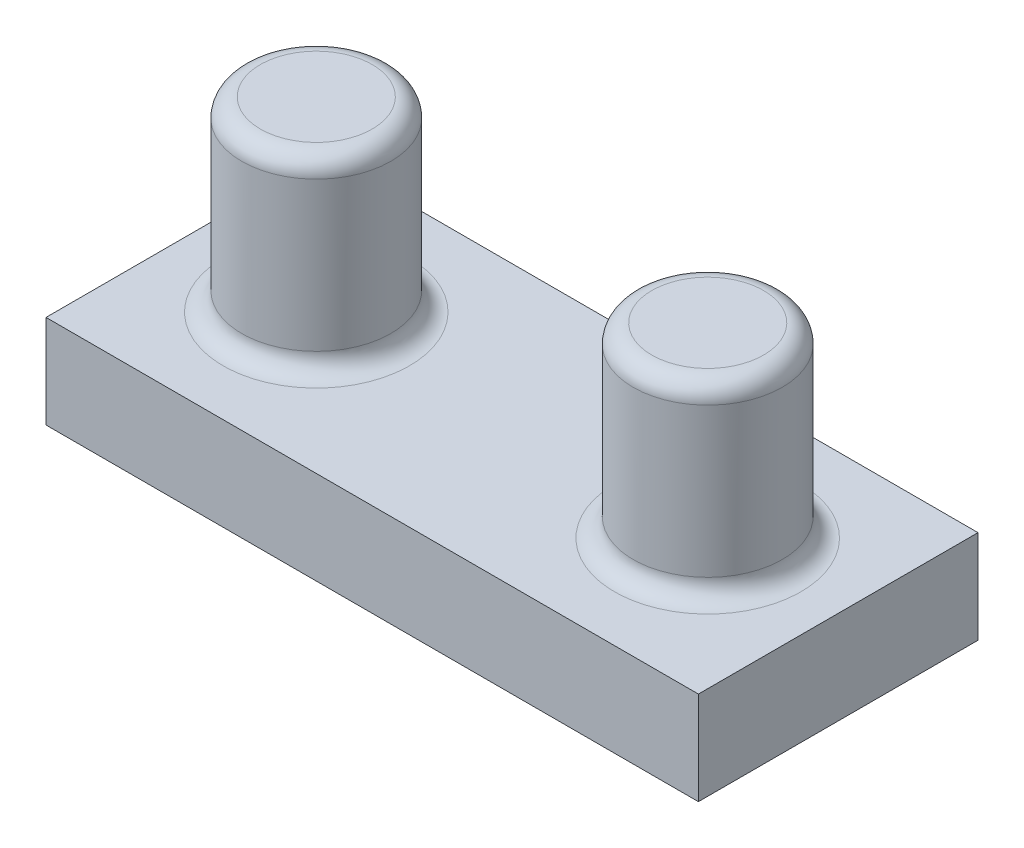
from build123d import *

# Parameters (mm, degrees)
SKETCH1_R             = 4
BOSS_EXTRUDE1_DEPTH   = 10
BOSS_EXTRUDE1_2_DEPTH = 10
SKETCH2_W             = 35
SKETCH2_H             = 15
BOSS_EXTRUDE2_DEPTH   = 5
FILLET1_R             = 1
CUT_EXTRUDE1_DEPTH    = 1


with BuildPart() as part:
    # Sketch1 → Boss-Extrude1 (new body)
    with BuildSketch(Plane(origin=(0, 0, 0), x_dir=(1, 0, 0), z_dir=(0, 1, 0))):
        with Locations(Location((10.086709746, 7.169703638, 0), (0, 0, 270))):
            Circle(SKETCH1_R)
    extrude(amount=BOSS_EXTRUDE1_DEPTH)



with BuildPart() as body_2:
    # Sketch1 → Boss-Extrude1 2 (new body)
    with BuildSketch(Plane(origin=(0, 0, 0), x_dir=(1, 0, 0), z_dir=(0, 1, 0))):
        with Locations(Location((-10.913290254, 7.169703638, 0), (0, 0, 270))):
            Circle(SKETCH1_R)
    extrude(amount=BOSS_EXTRUDE1_2_DEPTH)


with BuildPart() as part_1:
    add(part.part)

    add(body_2.part)  # Boss-Extrude2 merges body 2
    # Sketch2 → Boss-Extrude2 (add)
    with BuildSketch(Plane(origin=(0, 0, 0), x_dir=(-1, 0, 0), z_dir=(0, -1, 0))):
        with Locations((0.413290254, 7.169703638)):
            Rectangle(SKETCH2_W, SKETCH2_H)
    extrude(amount=BOSS_EXTRUDE2_DEPTH)

    # Fillet1
    fillet1_edges = [part_1.edges().sort_by_distance(p)[0] for p in [
        (-10.913290254, 0, -11.169703638),
        (-10.913290254, 10, -11.169703638),
        (10.086709746, 10, -11.169703638),
        (10.086709746, 0, -11.169703638),
    ]]
    fillet(fillet1_edges, radius=FILLET1_R)

    # Sketch3 → Cut-Extrude1 (cut)
    with BuildSketch(Plane(origin=(0, 0, -14.669703638), x_dir=(-1, 0, 0), z_dir=(0, 0, -1))):
        with BuildLine():
            Line((4.304418078, -1.853490886), (4.618520642, -1.853490886))
            Line((4.618520642, -1.853490886), (4.618520642, -2.298002104))
            add(Edge.make_bspline(
                [(4.618520642, -2.298002104), (4.646804592, -2.259114502), (4.700999351, -2.184602129), (4.789865004, -2.086411845), (4.878641116, -2.00308369), (4.942574498, -1.959340819), (4.97328827, -1.938326623)],
                knots=[0, 0, 0, 0, 1.134379233, 2.173579362, 3.122582517, 4, 4, 4, 4], degree=3))
            add(Edge.make_bspline(
                [(4.97328827, -1.938326623), (5.015152932, -1.918321258), (5.098150832, -1.878660045), (5.229570057, -1.838426486), (5.364044726, -1.813701385), (5.45485294, -1.810320011), (5.50053186, -1.808619091)],
                knots=[0, 0, 0, 0, 1.014936303, 2.012140481, 3.000054389, 4, 4, 4, 4], degree=3))
            add(Edge.make_bspline(
                [(5.50053186, -1.808619091), (5.531424856, -1.809664382), (5.592560435, -1.811732956), (5.683144526, -1.825192992), (5.771003137, -1.848459165), (5.855617167, -1.880866489), (5.935337846, -1.920113175), (6.008427044, -1.966162883), (6.074051252, -2.017859959), (6.132177303, -2.077538892), (6.184446329, -2.14687549), (6.232525175, -2.227739739), (6.276950388, -2.3219474), (6.301571696, -2.390313941), (6.314534264, -2.426307393)],
                knots=[0, 0, 0, 0, 1.009824226, 1.998387844, 2.986035974, 3.974953746, 4.955485308, 5.885931332, 6.793869504, 7.679848016, 8.601185859, 9.625726857, 10.749998409, 12, 12, 12, 12], degree=3))
            add(Edge.make_bspline(
                [(6.314534264, -2.426307393), (6.328245515, -2.401582973), (6.355227332, -2.352928788), (6.400532969, -2.284070526), (6.448000766, -2.219663734), (6.498035259, -2.15965731), (6.550459846, -2.10434758), (6.605521246, -2.053551678), (6.662906027, -2.007051464), (6.742698267, -1.952728305), (6.846510875, -1.895027123), (6.977398989, -1.844998679), (7.113549161, -1.814082551), (7.205966859, -1.810452278), (7.252635225, -1.808619091)],
                knots=[0, 0, 0, 0, 0.86119277, 1.694706429, 2.50939023, 3.298075842, 4.073795165, 4.829715201, 5.57930267, 6.321991688, 7.768977793, 9.186738141, 10.579381044, 12, 12, 12, 12], degree=3))
            add(Edge.make_bspline(
                [(7.252635225, -1.808619091), (7.295516688, -1.810236312), (7.379439874, -1.81340137), (7.50161714, -1.838254844), (7.615558945, -1.880932491), (7.721036021, -1.939166127), (7.816195835, -2.012345311), (7.898912144, -2.099414148), (7.968682507, -2.199756771), (8.014261147, -2.29414876), (8.045176411, -2.377484093), (8.064237646, -2.448490384), (8.081077341, -2.526641937), (8.095058586, -2.612032199), (8.105277138, -2.704962807), (8.112847854, -2.805281683), (8.117971927, -2.913066794), (8.118333999, -2.987432295), (8.118520642, -3.025766527)],
                knots=[0, 0, 0, 0, 1.209669288, 2.367440248, 3.500751976, 4.631527125, 5.755587489, 6.87532382, 8.007944318, 9.190864318, 9.82315674, 10.514484317, 11.263564316, 12.079023757, 12.955305781, 13.901327259, 14.918167583, 16, 16, 16, 16], degree=3))
            Line((8.118520642, -3.025766527), (8.118520642, -4.411183194))
            Line((8.118520642, -4.411183194), (7.804418078, -4.411183194))
            Line((7.804418078, -4.411183194), (7.804418078, -3.024364284))
            add(Edge.make_bspline(
                [(7.804418078, -3.024364284), (7.804340195, -2.99164371), (7.804190516, -2.928759743), (7.801496884, -2.838507292), (7.79642157, -2.756238934), (7.790486931, -2.682066846), (7.782243122, -2.615818058), (7.77159719, -2.557625639), (7.76031951, -2.507031828), (7.741583519, -2.45094578), (7.711635627, -2.38907557), (7.666018147, -2.322351994), (7.608548041, -2.264271194), (7.542187885, -2.213852877), (7.46663944, -2.172859236), (7.383374717, -2.143583226), (7.292910665, -2.125460348), (7.230287877, -2.123654332), (7.197947725, -2.122721655)],
                knots=[0, 0, 0, 0, 1.253487763, 2.409012846, 3.458416907, 4.410876679, 5.259312806, 6.014470957, 6.676830364, 7.243083969, 8.276244668, 9.299465089, 10.325150304, 11.392391894, 12.482080715, 13.603491619, 14.762376348, 16, 16, 16, 16], degree=3))
            add(Edge.make_bspline(
                [(7.197947725, -2.122721655), (7.158277771, -2.124137813), (7.07987486, -2.126936678), (6.965429373, -2.155510551), (6.855458357, -2.198590802), (6.753243224, -2.261023259), (6.659215433, -2.335831623), (6.578315856, -2.424781219), (6.51148367, -2.525411146), (6.466229694, -2.618557848), (6.437640393, -2.702227292), (6.418763477, -2.775324664), (6.404080085, -2.858406232), (6.390309556, -2.950913722), (6.381321828, -3.053483903), (6.373153456, -3.165642304), (6.369332593, -3.287726263), (6.368798134, -3.372352952), (6.368520642, -3.416291367)],
                knots=[0, 0, 0, 0, 1.090531906, 2.155305635, 3.229839962, 4.33261226, 5.44038871, 6.529323825, 7.629011124, 8.757537029, 9.370236727, 10.061839251, 10.834451254, 11.692844982, 12.636905849, 13.66920014, 14.789842145, 16, 16, 16, 16], degree=3))
            Line((6.368520642, -3.416291367), (6.368520642, -4.411183194))
            Line((6.368520642, -4.411183194), (6.054418078, -4.411183194))
            Line((6.054418078, -4.411183194), (6.054418078, -3.110602264))
            add(Edge.make_bspline(
                [(6.054418078, -3.110602264), (6.054338647, -3.073908946), (6.05418583, -3.003314688), (6.051509512, -2.902081013), (6.046422891, -2.809999933), (6.040542342, -2.727178469), (6.032082164, -2.65376714), (6.022472402, -2.589372382), (6.011123791, -2.534155631), (5.992333906, -2.473592247), (5.963619438, -2.406871324), (5.917431176, -2.335730302), (5.859823596, -2.273462205), (5.79225272, -2.220303456), (5.716247038, -2.176361975), (5.632263637, -2.144702223), (5.541058724, -2.126277934), (5.478181018, -2.123929437), (5.44584436, -2.122721655)],
                knots=[0, 0, 0, 0, 1.320475261, 2.540461679, 3.643808994, 4.639130445, 5.527981419, 6.302341397, 6.981980563, 7.553956391, 8.582137848, 9.585246428, 10.591171744, 11.620968678, 12.668337649, 13.738356861, 14.836885341, 16, 16, 16, 16], degree=3))
            add(Edge.make_bspline(
                [(5.44584436, -2.122721655), (5.407828148, -2.124252115), (5.332063189, -2.127302268), (5.220761219, -2.154756542), (5.113275536, -2.197760617), (5.011320837, -2.257420436), (4.917646689, -2.331319514), (4.835638421, -2.41823441), (4.766695896, -2.517083444), (4.720964081, -2.60924796), (4.691465607, -2.690821235), (4.671870272, -2.760172183), (4.655030646, -2.837172431), (4.642516625, -2.922059542), (4.630436209, -3.014280636), (4.6246059, -3.114295126), (4.618934338, -3.222017214), (4.618661923, -3.296389759), (4.618520642, -3.334961239)],
                knots=[0, 0, 0, 0, 1.098833095, 2.189935336, 3.297829714, 4.440610912, 5.596351641, 6.740013378, 7.886572111, 9.072425424, 9.705826452, 10.395263256, 11.156850408, 11.985370555, 12.878090359, 13.847760091, 14.883794034, 16, 16, 16, 16], degree=3))
            Line((4.618520642, -3.334961239), (4.618520642, -4.411183194))
            Line((4.618520642, -4.411183194), (4.304418078, -4.411183194))
            Line((4.304418078, -4.411183194), (4.304418078, -1.853490886))
        make_face()
        with BuildLine():
            Line((-0.227633204, -1.853490886), (0.08646936, -1.853490886))
            Line((0.08646936, -1.853490886), (0.08646936, -2.298002104))
            add(Edge.make_bspline(
                [(0.08646936, -2.298002104), (0.11475331, -2.259114502), (0.168948069, -2.184602129), (0.257813722, -2.086411845), (0.346589834, -2.00308369), (0.410523216, -1.959340819), (0.441236988, -1.938326623)],
                knots=[0, 0, 0, 0, 1.134379233, 2.173579362, 3.122582517, 4, 4, 4, 4], degree=3))
            add(Edge.make_bspline(
                [(0.441236988, -1.938326623), (0.48310165, -1.918321258), (0.56609955, -1.878660045), (0.697518775, -1.838426486), (0.831993444, -1.813701385), (0.922801658, -1.810320011), (0.968480578, -1.808619091)],
                knots=[0, 0, 0, 0, 1.014936303, 2.012140481, 3.000054389, 4, 4, 4, 4], degree=3))
            add(Edge.make_bspline(
                [(0.968480578, -1.808619091), (0.999373574, -1.809664382), (1.060509153, -1.811732956), (1.151093243, -1.825192992), (1.238951855, -1.848459165), (1.323565885, -1.880866489), (1.403286564, -1.920113175), (1.476375762, -1.966162883), (1.54199997, -2.017859959), (1.600126021, -2.077538892), (1.652395047, -2.14687549), (1.700473893, -2.227739739), (1.744899106, -2.3219474), (1.769520414, -2.390313941), (1.782482982, -2.426307393)],
                knots=[0, 0, 0, 0, 1.009824226, 1.998387844, 2.986035974, 3.974953746, 4.955485308, 5.885931332, 6.793869504, 7.679848016, 8.601185859, 9.625726857, 10.749998409, 12, 12, 12, 12], degree=3))
            add(Edge.make_bspline(
                [(1.782482982, -2.426307393), (1.796194233, -2.401582973), (1.82317605, -2.352928788), (1.868481687, -2.284070526), (1.915949484, -2.219663734), (1.965983977, -2.15965731), (2.018408564, -2.10434758), (2.073469964, -2.053551678), (2.130854745, -2.007051464), (2.210646985, -1.952728305), (2.314459593, -1.895027123), (2.445347707, -1.844998679), (2.581497879, -1.814082551), (2.673915577, -1.810452278), (2.720583943, -1.808619091)],
                knots=[0, 0, 0, 0, 0.86119277, 1.694706429, 2.50939023, 3.298075842, 4.073795165, 4.829715201, 5.57930267, 6.321991688, 7.768977793, 9.186738141, 10.579381044, 12, 12, 12, 12], degree=3))
            add(Edge.make_bspline(
                [(2.720583943, -1.808619091), (2.763465406, -1.810236312), (2.847388592, -1.81340137), (2.969565858, -1.838254844), (3.083507663, -1.880932491), (3.188984739, -1.939166127), (3.284144553, -2.012345311), (3.366860862, -2.099414148), (3.436631225, -2.199756771), (3.482209865, -2.29414876), (3.513125129, -2.377484093), (3.532186364, -2.448490384), (3.549026059, -2.526641937), (3.563007304, -2.612032199), (3.573225856, -2.704962807), (3.580796572, -2.805281683), (3.585920645, -2.913066794), (3.586282717, -2.987432295), (3.58646936, -3.025766527)],
                knots=[0, 0, 0, 0, 1.209669288, 2.367440248, 3.500751976, 4.631527125, 5.755587489, 6.87532382, 8.007944318, 9.190864318, 9.82315674, 10.514484317, 11.263564316, 12.079023757, 12.955305781, 13.901327259, 14.918167583, 16, 16, 16, 16], degree=3))
            Line((3.58646936, -3.025766527), (3.58646936, -4.411183194))
            Line((3.58646936, -4.411183194), (3.272366796, -4.411183194))
            Line((3.272366796, -4.411183194), (3.272366796, -3.024364284))
            add(Edge.make_bspline(
                [(3.272366796, -3.024364284), (3.272288913, -2.99164371), (3.272139234, -2.928759743), (3.269445602, -2.838507292), (3.264370288, -2.756238934), (3.258435649, -2.682066846), (3.25019184, -2.615818058), (3.239545908, -2.557625639), (3.228268228, -2.507031828), (3.209532237, -2.45094578), (3.179584345, -2.38907557), (3.133966865, -2.322351994), (3.076496759, -2.264271194), (3.010136603, -2.213852877), (2.934588158, -2.172859236), (2.851323435, -2.143583226), (2.760859383, -2.125460348), (2.698236595, -2.123654332), (2.665896443, -2.122721655)],
                knots=[0, 0, 0, 0, 1.253487763, 2.409012846, 3.458416907, 4.410876679, 5.259312806, 6.014470957, 6.676830364, 7.243083969, 8.276244668, 9.299465089, 10.325150304, 11.392391894, 12.482080715, 13.603491619, 14.762376348, 16, 16, 16, 16], degree=3))
            add(Edge.make_bspline(
                [(2.665896443, -2.122721655), (2.626226489, -2.124137813), (2.547823578, -2.126936678), (2.433378091, -2.155510551), (2.323407075, -2.198590802), (2.221191942, -2.261023259), (2.127164151, -2.335831623), (2.046264573, -2.424781219), (1.979432388, -2.525411146), (1.934178412, -2.618557848), (1.905589111, -2.702227292), (1.886712195, -2.775324664), (1.872028803, -2.858406232), (1.858258274, -2.950913722), (1.849270546, -3.053483903), (1.841102174, -3.165642304), (1.837281311, -3.287726263), (1.836746852, -3.372352952), (1.83646936, -3.416291367)],
                knots=[0, 0, 0, 0, 1.090531906, 2.155305635, 3.229839962, 4.33261226, 5.44038871, 6.529323825, 7.629011124, 8.757537029, 9.370236727, 10.061839251, 10.834451254, 11.692844982, 12.636905849, 13.66920014, 14.789842145, 16, 16, 16, 16], degree=3))
            Line((1.83646936, -3.416291367), (1.83646936, -4.411183194))
            Line((1.83646936, -4.411183194), (1.522366796, -4.411183194))
            Line((1.522366796, -4.411183194), (1.522366796, -3.110602264))
            add(Edge.make_bspline(
                [(1.522366796, -3.110602264), (1.522287365, -3.073908946), (1.522134548, -3.003314688), (1.51945823, -2.902081013), (1.514371609, -2.809999933), (1.50849106, -2.727178469), (1.500030882, -2.65376714), (1.49042112, -2.589372382), (1.479072509, -2.534155631), (1.460282624, -2.473592247), (1.431568156, -2.406871324), (1.385379894, -2.335730302), (1.327772314, -2.273462205), (1.260201438, -2.220303456), (1.184195756, -2.176361975), (1.100212355, -2.144702223), (1.009007442, -2.126277934), (0.946129736, -2.123929437), (0.913793078, -2.122721655)],
                knots=[0, 0, 0, 0, 1.320475261, 2.540461679, 3.643808994, 4.639130445, 5.527981419, 6.302341397, 6.981980563, 7.553956391, 8.582137848, 9.585246428, 10.591171744, 11.620968678, 12.668337649, 13.738356861, 14.836885341, 16, 16, 16, 16], degree=3))
            add(Edge.make_bspline(
                [(0.913793078, -2.122721655), (0.875776866, -2.124252115), (0.800011907, -2.127302268), (0.688709937, -2.154756542), (0.581224254, -2.197760617), (0.479269555, -2.257420436), (0.385595407, -2.331319514), (0.303587139, -2.41823441), (0.234644614, -2.517083444), (0.188912799, -2.60924796), (0.159414325, -2.690821235), (0.13981899, -2.760172183), (0.122979364, -2.837172431), (0.110465342, -2.922059542), (0.098384927, -3.014280636), (0.092554618, -3.114295126), (0.086883056, -3.222017214), (0.086610641, -3.296389759), (0.08646936, -3.334961239)],
                knots=[0, 0, 0, 0, 1.098833095, 2.189935336, 3.297829714, 4.440610912, 5.596351641, 6.740013378, 7.886572111, 9.072425424, 9.705826452, 10.395263256, 11.156850408, 11.985370555, 12.878090359, 13.847760091, 14.883794034, 16, 16, 16, 16], degree=3))
            Line((0.08646936, -3.334961239), (0.08646936, -4.411183194))
            Line((0.08646936, -4.411183194), (-0.227633204, -4.411183194))
            Line((-0.227633204, -4.411183194), (-0.227633204, -1.853490886))
        make_face()
        Polygon((-3.746563493, -0.911183194), (-3.099428076, -0.911183194), (-3.099428076, -4.411183194), (-3.41353064, -4.411183194), (-3.41353064, -1.270157553), (-3.951992179, -1.270157553), align=None)
        with BuildLine():
            Line((-6.734043461, -1.988106271), (-7.048146025, -1.988106271))
            add(Edge.make_bspline(
                [(-7.048146025, -1.988106271), (-7.046098872, -1.946435383), (-7.042078318, -1.864594868), (-7.023250029, -1.745270962), (-6.996309151, -1.631216163), (-6.958217697, -1.523346249), (-6.91091142, -1.420707442), (-6.854181392, -1.323707426), (-6.786987542, -1.232716238), (-6.710780808, -1.148577394), (-6.628012169, -1.071389824), (-6.538706229, -1.004734581), (-6.444861202, -0.94841691), (-6.346761803, -0.901335668), (-6.243301239, -0.865995822), (-6.135418381, -0.839774182), (-6.022639245, -0.823997836), (-5.945799223, -0.822302051), (-5.906719743, -0.821439604)],
                knots=[0, 0, 0, 0, 1.10065271, 2.161652631, 3.183658789, 4.190468796, 5.17591951, 6.163126047, 7.15150782, 8.156236427, 9.156009102, 10.134482811, 11.092018607, 12.041330605, 13.001268258, 13.972401359, 14.968799086, 16, 16, 16, 16], degree=3))
            add(Edge.make_bspline(
                [(-5.906719743, -0.821439604), (-5.868341669, -0.822338061), (-5.792930124, -0.824103495), (-5.68286811, -0.839264525), (-5.578090815, -0.863010116), (-5.478803049, -0.896325533), (-5.385796984, -0.94110996), (-5.298373939, -0.994907499), (-5.215493129, -1.05712733), (-5.140886345, -1.130381144), (-5.072378266, -1.208583528), (-5.013276011, -1.292071432), (-4.962662847, -1.378300717), (-4.920475167, -1.467928919), (-4.889419028, -1.561799947), (-4.86584082, -1.65854715), (-4.852513407, -1.759171961), (-4.850467983, -1.827278517), (-4.849428076, -1.861904348)],
                knots=[0, 0, 0, 0, 1.111607364, 2.184268762, 3.212621178, 4.221274766, 5.211760367, 6.196651075, 7.1921475, 8.207485113, 9.220403448, 10.201281604, 11.166441695, 12.114753415, 13.065576456, 14.026450734, 14.996634279, 16, 16, 16, 16], degree=3))
            add(Edge.make_bspline(
                [(-4.849428076, -1.861904348), (-4.851121339, -1.910652182), (-4.85447815, -2.007292396), (-4.883192527, -2.149307259), (-4.928039038, -2.286900678), (-4.982036395, -2.39763798), (-5.036508839, -2.486871474), (-5.085596346, -2.560340179), (-5.143061157, -2.639445647), (-5.209739655, -2.723922984), (-5.284252528, -2.814433889), (-5.367274691, -2.910923685), (-5.459398173, -3.012395455), (-5.524056674, -3.081701056), (-5.557561089, -3.117613482)],
                knots=[0, 0, 0, 0, 1.184426356, 2.348067706, 3.509069118, 4.696110526, 5.333549288, 6.050745305, 6.844228056, 7.710549037, 8.667450064, 9.695053472, 10.805634456, 12, 12, 12, 12], degree=3))
            Line((-5.557561089, -3.117613482), (-6.433262211, -4.052208835))
            Line((-6.433262211, -4.052208835), (-4.804556281, -4.052208835))
            Line((-4.804556281, -4.052208835), (-4.804556281, -4.411183194))
            Line((-4.804556281, -4.411183194), (-7.182761409, -4.411183194))
            Line((-7.182761409, -4.411183194), (-5.825389615, -2.962665566))
            add(Edge.make_bspline(
                [(-5.825389615, -2.962665566), (-5.792341728, -2.928167259), (-5.728863501, -2.861903073), (-5.639080924, -2.765160112), (-5.558441935, -2.675410572), (-5.486424543, -2.592824023), (-5.424591037, -2.516192455), (-5.369718805, -2.447997752), (-5.325753214, -2.385243302), (-5.278037819, -2.312502688), (-5.231823837, -2.22369037), (-5.192111481, -2.115156681), (-5.167896633, -2.003429429), (-5.164991797, -1.927927391), (-5.16353064, -1.88994922)],
                knots=[0, 0, 0, 0, 1.329631726, 2.553950428, 3.673215718, 4.687767853, 5.603093632, 6.413772471, 7.123043292, 7.734684054, 8.834405432, 9.900288307, 10.943827018, 12, 12, 12, 12], degree=3))
            add(Edge.make_bspline(
                [(-5.16353064, -1.88994922), (-5.164166382, -1.866067821), (-5.165419308, -1.819002171), (-5.176477006, -1.749996412), (-5.193187512, -1.683431598), (-5.21713277, -1.619102979), (-5.24873951, -1.557657327), (-5.28721289, -1.499019847), (-5.331602954, -1.442330881), (-5.382954223, -1.389177583), (-5.439365743, -1.340496378), (-5.498959992, -1.297372292), (-5.562010097, -1.261333182), (-5.628250219, -1.231789684), (-5.697495688, -1.208614303), (-5.769880433, -1.192555724), (-5.84520445, -1.18247324), (-5.896637945, -1.181109068), (-5.922845544, -1.180413963)],
                knots=[0, 0, 0, 0, 0.991446411, 1.95395049, 2.89581595, 3.838931463, 4.798493298, 5.75982156, 6.748411868, 7.785213223, 8.824556874, 9.840280684, 10.836137867, 11.835679398, 12.848801643, 13.863922112, 14.911575587, 16, 16, 16, 16], degree=3))
            add(Edge.make_bspline(
                [(-5.922845544, -1.180413963), (-5.950216377, -1.181128995), (-6.003968173, -1.182533201), (-6.082887206, -1.192355865), (-6.158172983, -1.209301705), (-6.230014886, -1.232478379), (-6.298534472, -1.261936928), (-6.363398516, -1.298628673), (-6.424461406, -1.342412166), (-6.481837929, -1.392052722), (-6.534701908, -1.447320324), (-6.581148784, -1.508930287), (-6.621732798, -1.575757702), (-6.657142031, -1.647622253), (-6.685897722, -1.725176033), (-6.707870872, -1.808143738), (-6.725257719, -1.896165119), (-6.731066239, -1.956950204), (-6.734043461, -1.988106271)],
                knots=[0, 0, 0, 0, 1.031018746, 2.02475058, 2.990194455, 3.934040569, 4.864654155, 5.795059489, 6.735614925, 7.690564532, 8.649604399, 9.611025574, 10.590972636, 11.591080095, 12.624614302, 13.701020113, 14.821632451, 16, 16, 16, 16], degree=3))
        make_face()
    extrude(amount=-CUT_EXTRUDE1_DEPTH, mode=Mode.SUBTRACT)


solid = part_1.part
